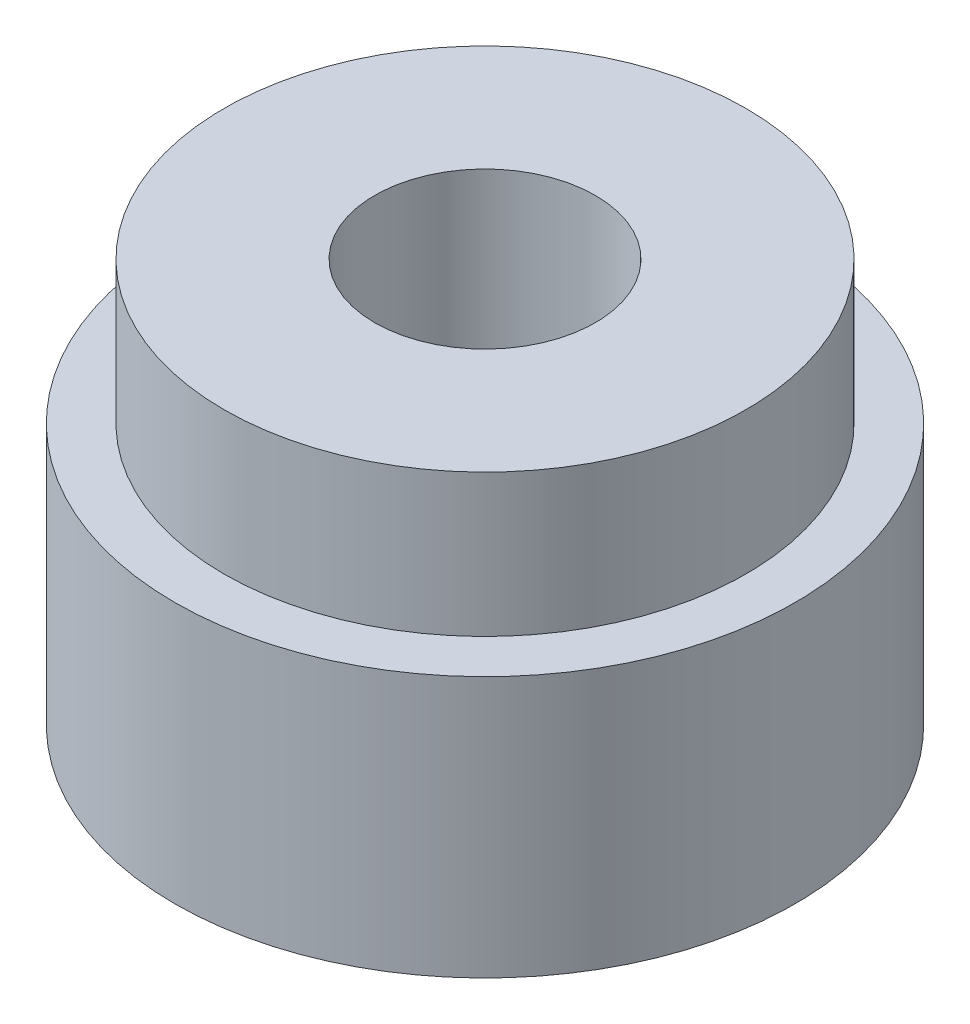
from build123d import *

# Parameters (mm, degrees)
SKETCH1_R           = 11
SKETCH1_R_2         = 4.65
BOSS_EXTRUDE1_DEPTH = 17
SKETCH1_5_R         = 13.075
SKETCH1_5_R_2       = 11
BOSS_EXTRUDE2_DEPTH = 11
SKETCH2_R           = 9
CUT_EXTRUDE1_DEPTH  = 9.15


with BuildPart() as part:
    # Sketch1 → Boss-Extrude1 (new body)
    with BuildSketch(Plane(origin=(0, 0, 0), x_dir=(1, 0, 0), z_dir=(0, 1, 0))):
        Circle(SKETCH1_R)
        Circle(SKETCH1_R_2, mode=Mode.SUBTRACT)
    extrude(amount=BOSS_EXTRUDE1_DEPTH)

    # Sketch1<5> → Boss-Extrude2 (add)
    with BuildSketch(Plane(origin=(0, 0, 0), x_dir=(1, 0, 0), z_dir=(0, 1, 0))):
        Circle(SKETCH1_5_R)
        Circle(SKETCH1_5_R_2, mode=Mode.SUBTRACT)
    extrude(amount=BOSS_EXTRUDE2_DEPTH)

    # Sketch2 → Cut-Extrude1 (cut)
    with BuildSketch(Plane.XZ):
        Circle(SKETCH2_R)
    extrude(amount=-CUT_EXTRUDE1_DEPTH, mode=Mode.SUBTRACT)


solid = part.part
